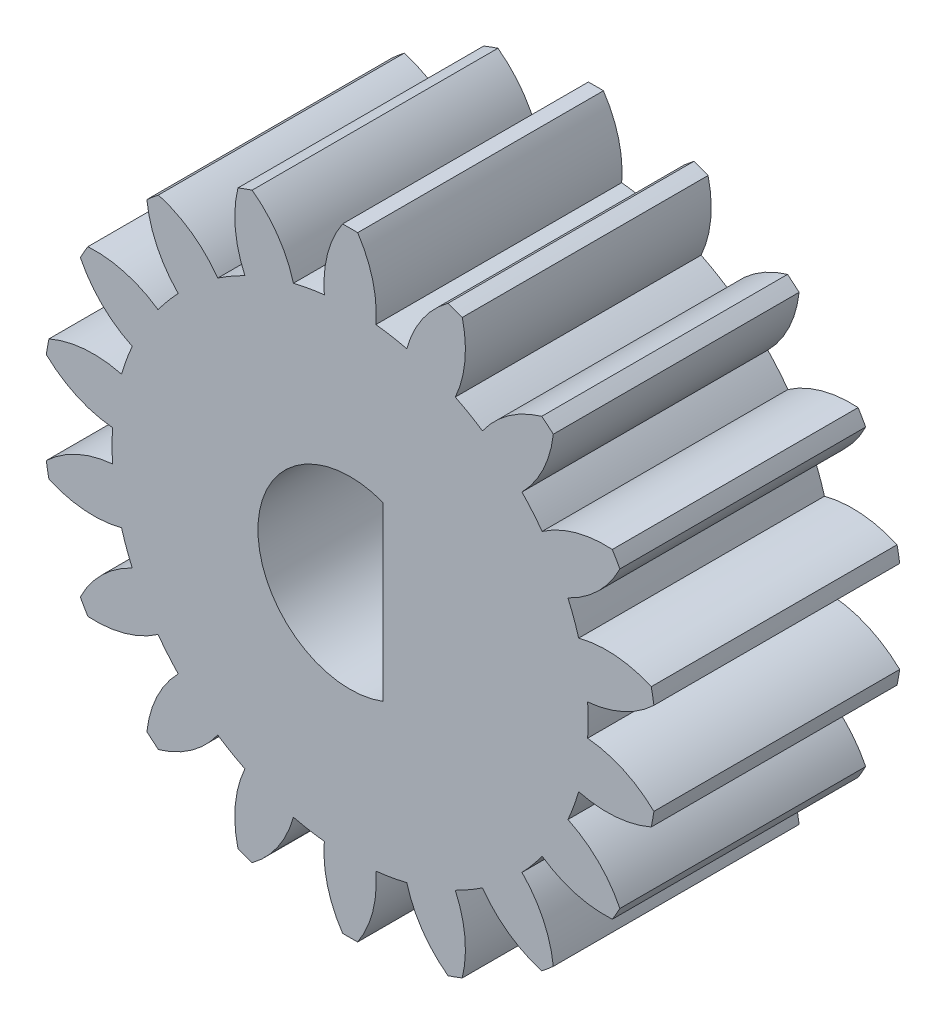
from build123d import *

# Parameters (mm, degrees)
BASPROSKE_W           = 4
BASPROSKE_H           = 5
TOOTHCUT_DEPTH        = 9.124038405
TEETHCUTS_COUNT       = 18
TEETHCUTS_ANGLE       = 340
BORE_DEPTH            = 50.0000508
BODY_MOVE_COPY1_ANGLE = 90
BODY_MOVE_COPY2_ANGLE = 90


with BuildPart() as part:
    # BasProSke → Base-Revolve (revolve)
    with BuildSketch(Plane(origin=(0, 0, 0), x_dir=(1, 0, 0), z_dir=(0, 1, 0)), mode=Mode.PRIVATE) as base_revolve_sk:
        with Locations((2, 2.5)):
            Rectangle(BASPROSKE_W, BASPROSKE_H)
    revolve(base_revolve_sk.sketch.rotate(Axis((-10, 0, 0), (1, 0, 0)), 180), axis=Axis((-10, 0, 0), (1, 0, 0)))

    # TooCutSke → ToothCut (cut, through all)
    with BuildSketch(Plane(origin=(0, 0, 0), x_dir=(0, 0, -1), z_dir=(1, 0, 0))):
        with BuildLine():
            ThreePointArc((0.25527463, 3.865580275), (0, 3.874), (-0.25527463, 3.865580275))
            ThreePointArc((-0.25527463, 3.865580275), (-0.416281865, 4.46052923), (-0.768562654, 4.96628197))
            ThreePointArc((-0.768562654, 4.96628197), (0, 5.0254), (0.768562654, 4.96628197))
            ThreePointArc((0.768562654, 4.96628197), (0.416281865, 4.46052923), (0.25527463, 3.865580275))
        make_face()
    toothcut = extrude(amount=TOOTHCUT_DEPTH, mode=Mode.SUBTRACT)

    # TeethCuts: ToothCut ×18 about axis
    teethcuts_axis = Axis((-10, 0, 0), (1, 0, 0))
    for i in range(1, TEETHCUTS_COUNT):
        add(toothcut.rotate(teethcuts_axis, i * TEETHCUTS_ANGLE / (TEETHCUTS_COUNT - 1)), mode=Mode.SUBTRACT)

    # BorSke → Bore (cut, symmetric)
    with BuildSketch(Plane(origin=(0, 0, 0), x_dir=(0, 0, -1), z_dir=(1, 0, 0))):
        with BuildLine():
            ThreePointArc((-1.401240549, 0.535280228), (-1.235499968, -0.850611444), (0, -1.5))
            Line((0, -1.5), (0, 0.535280228))
            Line((0, 0.535280228), (-1.401240549, 0.535280228))
        make_face()
        with BuildLine():
            Line((0, 0.535280228), (0, -1.5))
            ThreePointArc((0, -1.5), (1.060660172, -1.060660172), (1.5, 0))
            ThreePointArc((1.5, 0), (1.475103526, 0.272157285), (1.401240549, 0.535280228))
            Line((1.401240549, 0.535280228), (0, 0.535280228))
        make_face()
    extrude(amount=BORE_DEPTH, both=True, mode=Mode.SUBTRACT)


with BuildPart() as part_1:
    # Body-Move/Copy1: moved
    add(part.part.rotate(Axis((2, 0, 0), (0, 0, -1)), BODY_MOVE_COPY1_ANGLE))


with BuildPart() as part_2:
    # Body-Move/Copy2: moved
    add(part_1.part.rotate(Axis((0, 0, 0), (1, 0, 0)), BODY_MOVE_COPY2_ANGLE))


solid = part_2.part
